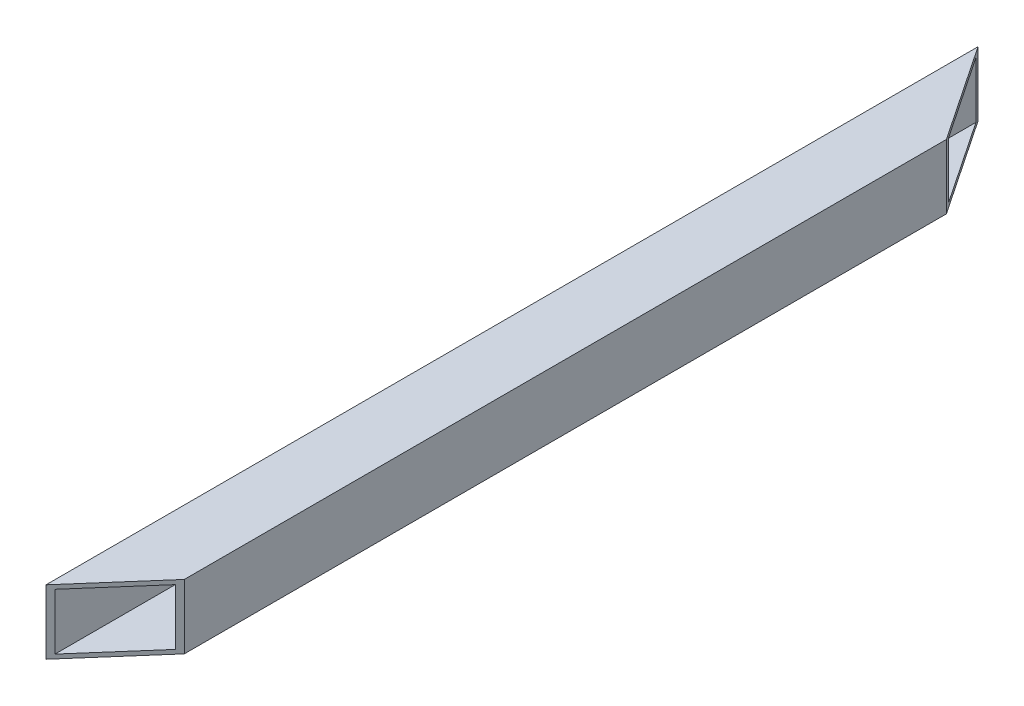
from build123d import *

# Parameters (mm, degrees)
SKETCH1_W           = 25.4
SKETCH1_H           = 25.4
BOSS_EXTRUDE1_DEPTH = 367.12
CUT_EXTRUDE1_DEPTH  = 380
CUT_EXTRUDE2_DEPTH  = 380
SHELL1_T            = -1.651


with BuildPart() as part:
    # Sketch1 → Boss-Extrude1 (new body)
    with BuildSketch(Plane.XY):
        with Locations((12.7, 12.7)):
            Rectangle(SKETCH1_W, SKETCH1_H)
    extrude(amount=BOSS_EXTRUDE1_DEPTH)

    # Sketch2 → Cut-Extrude1 (cut)
    with BuildSketch(Plane(origin=(0, 25.4, 0), x_dir=(1, 0, 0), z_dir=(0, 1, 0))):
        Polygon((0, 0), (25.4, -37.855551052), (25.4, 0), align=None)
    extrude(amount=-CUT_EXTRUDE1_DEPTH, mode=Mode.SUBTRACT)

    # Sketch3 → Cut-Extrude2 (cut)
    with BuildSketch(Plane(origin=(0, 25.4, 0), x_dir=(1, 0, 0), z_dir=(0, 1, 0))):
        Polygon((0, -367.12), (25.4, -338.043933141), (25.4, -367.12), align=None)
    extrude(amount=-CUT_EXTRUDE2_DEPTH, mode=Mode.SUBTRACT)

    # Shell1
    shell1_openings = [part.faces().sort_by_distance(p)[0] for p in [
        (12.7, 12.7, 18.927775526),
        (12.7, 12.7, 352.58196657),
    ]]
    offset(amount=SHELL1_T, openings=shell1_openings, kind=Kind.INTERSECTION)


solid = part.part
